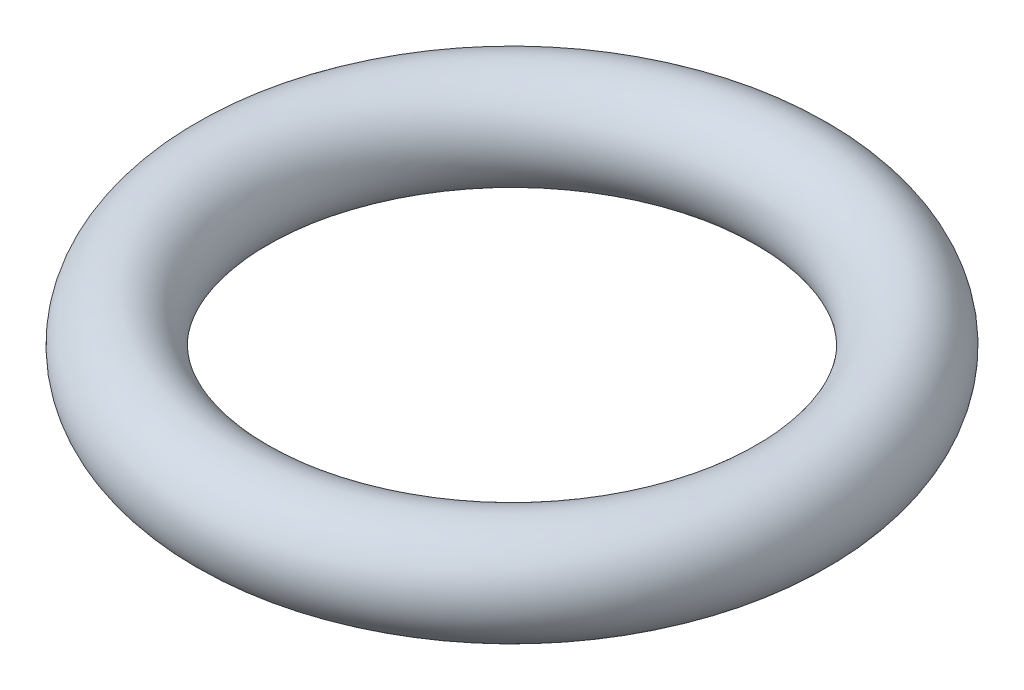
from build123d import *

# Parameters (mm, degrees)
SKETCH2_R = 2.5


with BuildPart() as part:
    # Sweep1: sweep along a path in Sketch1
    with BuildLine(Plane(origin=(0, 0, 0), x_dir=(1, 0, 0), z_dir=(0, 1, 0))) as sweep1_path:
        CenterArc((0, 0), 13.975388379, 0, 360)
    # Sketch2 → Sweep1 (sweep)
    with BuildSketch(Plane(origin=(0, 0, 0), x_dir=(0, 0, -1), z_dir=(1, 0, 0))):
        with Locations((-13.975388379, 0)):
            Circle(SKETCH2_R)
    sweep(path=sweep1_path.line)


solid = part.part
